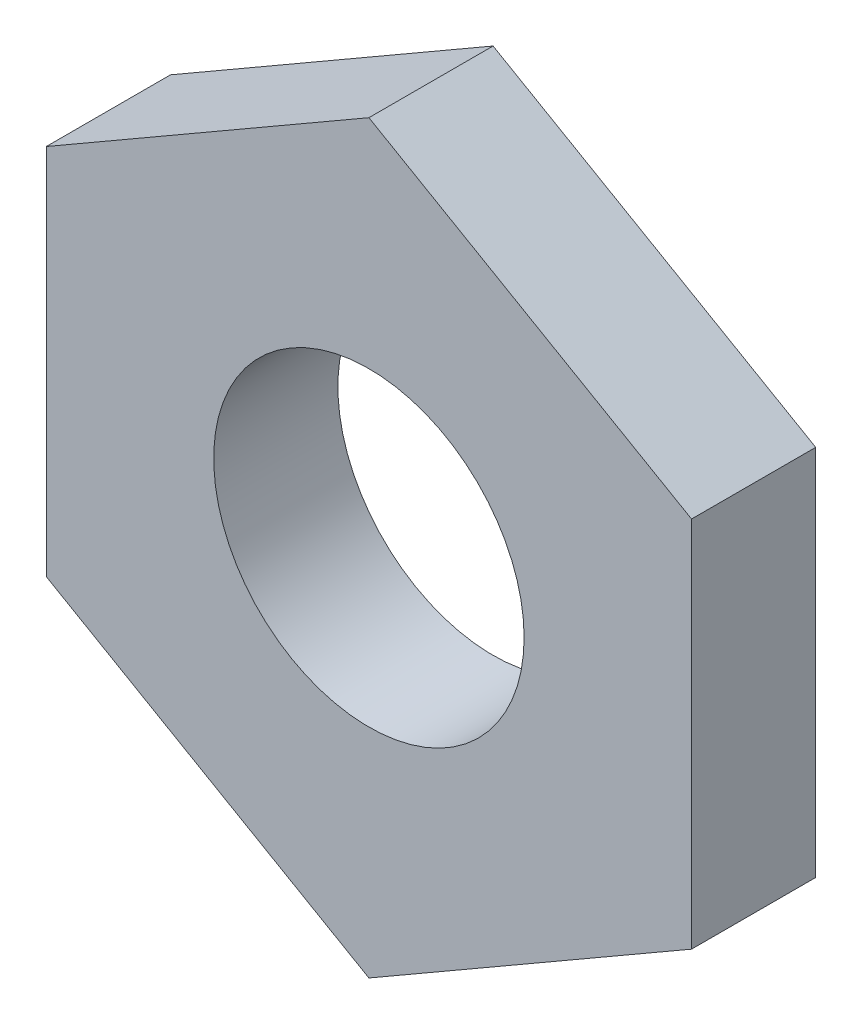
from build123d import *

# Parameters (mm, degrees)
ESQUISSE1_R        = 1.25
BOSS_EXTRU_3_DEPTH = 1


with BuildPart() as part:
    # Esquisse1 → Boss.-Extru.3 (new body)
    with BuildSketch(Plane.XY):
        Polygon((0, 3), (-2.598076211, 1.5), (-2.598076211, -1.5), (0, -3), (2.598076211, -1.5), (2.598076211, 1.5), align=None)
        Circle(ESQUISSE1_R, mode=Mode.SUBTRACT)
    extrude(amount=BOSS_EXTRU_3_DEPTH)


solid = part.part
